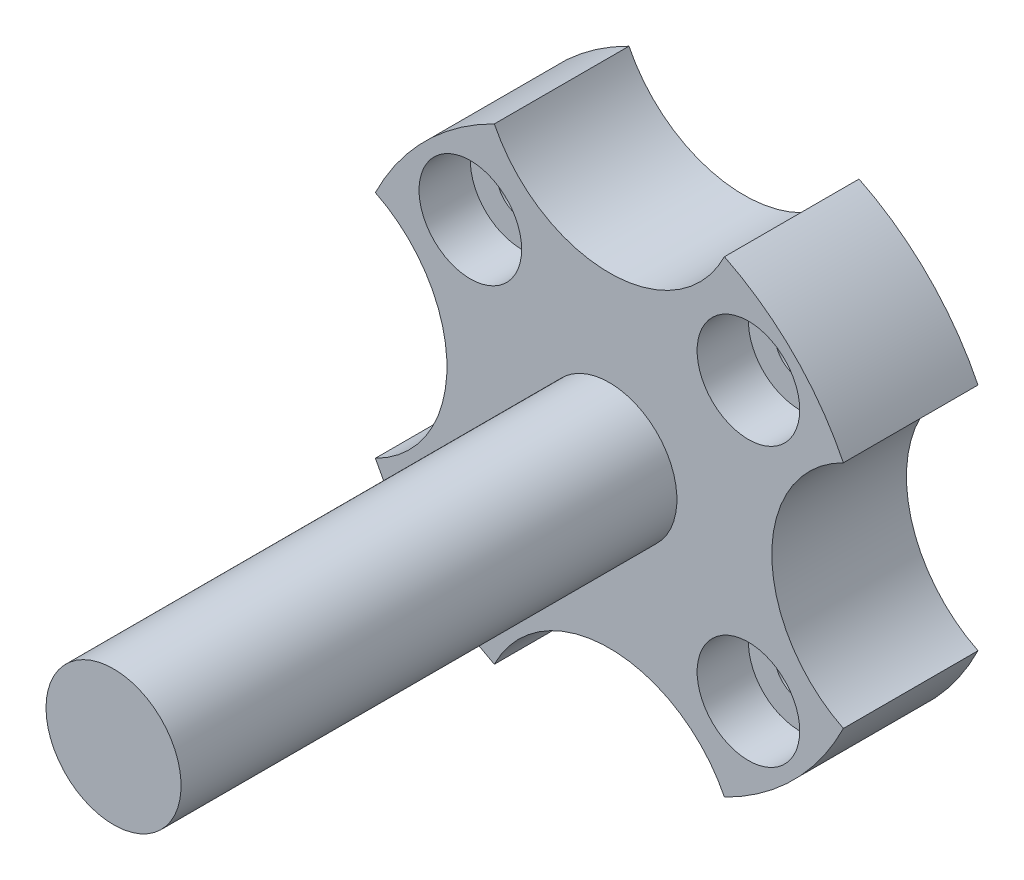
from build123d import *

# Parameters (mm, degrees)
BOSS_EXTRUDE1_DEPTH = 7.874
SKETCH2_R           = 1.4351
CUT_EXTRUDE1_DEPTH  = 7.874
SKETCH3_R           = 3
CUT_EXTRUDE2_DEPTH  = 3
SKETCH4_R           = 3.95
BOSS_EXTRUDE2_DEPTH = 29


with BuildPart() as part:
    # Sketch1 → Boss-Extrude1 (new body)
    with BuildSketch(Plane.XY):
        with BuildLine():
            ThreePointArc((6.727938916, 13.685661765), (0, 9.5), (-6.727938916, 13.685661765))
            ThreePointArc((-6.727938916, 13.685661765), (-10.783378413, 10.783378413), (-13.685661765, 6.727938916))
            ThreePointArc((-13.685661765, 6.727938916), (-9.5, 0), (-13.685661765, -6.727938916))
            ThreePointArc((-13.685661765, -6.727938916), (-10.783378413, -10.783378413), (-6.727938916, -13.685661765))
            ThreePointArc((-6.727938916, -13.685661765), (0, -9.5), (6.727938916, -13.685661765))
            ThreePointArc((6.727938916, -13.685661765), (10.783378413, -10.783378413), (13.685661765, -6.727938916))
            ThreePointArc((13.685661765, -6.727938916), (9.5, 0), (13.685661765, 6.727938916))
            ThreePointArc((13.685661765, 6.727938916), (10.783378413, 10.783378413), (6.727938916, 13.685661765))
        make_face()
    extrude(amount=BOSS_EXTRUDE1_DEPTH)

    # Sketch2 → Cut-Extrude1 (cut)
    with BuildSketch(Plane.XY.offset(7.874)):
        with Locations((-8.131727984, 8.131727984)):
            Circle(SKETCH2_R)
        with Locations((8.131727984, -8.131727984)):
            Circle(SKETCH2_R)
        with Locations((-8.131727984, -8.131727984)):
            Circle(SKETCH2_R)
        with Locations((8.131727984, 8.131727984)):
            Circle(SKETCH2_R)
    extrude(amount=-CUT_EXTRUDE1_DEPTH, mode=Mode.SUBTRACT)

    # Sketch3 → Cut-Extrude2 (cut)
    with BuildSketch(Plane.XY.offset(7.874)):
        with Locations((-8.131727984, 8.131727984)):
            Circle(SKETCH3_R)
        with Locations((-8.131727984, -8.131727984)):
            Circle(SKETCH3_R)
        with Locations((8.131727984, -8.131727984)):
            Circle(SKETCH3_R)
        with Locations((8.131727984, 8.131727984)):
            Circle(SKETCH3_R)
    extrude(amount=-CUT_EXTRUDE2_DEPTH, mode=Mode.SUBTRACT)

    # Sketch4 → Boss-Extrude2 (add)
    with BuildSketch(Plane.XY.offset(7.874)):
        with Locations(Location((0, 0, 0), (0, 0, 180))):
            Circle(SKETCH4_R)
    extrude(amount=BOSS_EXTRUDE2_DEPTH)


solid = part.part
